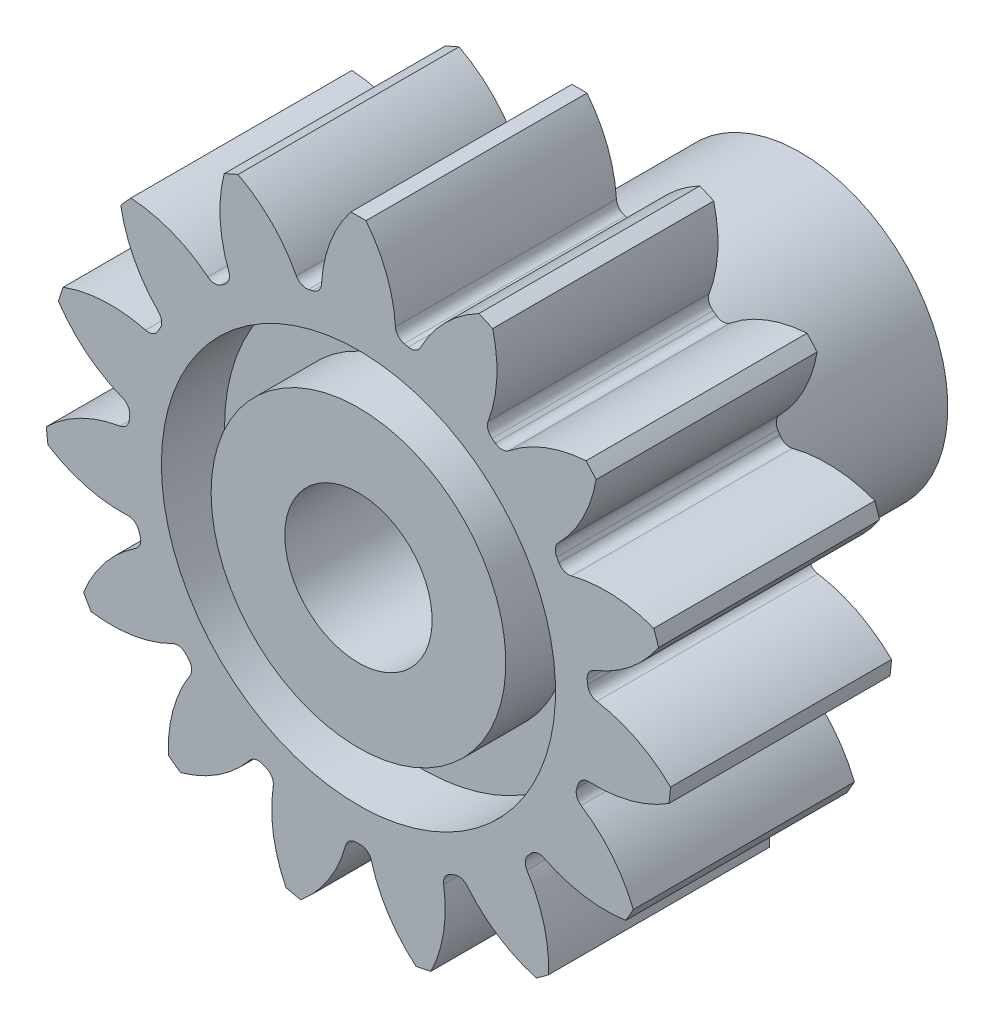
from build123d import *

# Parameters (mm, degrees)
CUT_EXTRUDE1_DEPTH = 17.985287751
CIRPATTERN1_COUNT  = 15


with BuildPart() as part:
    # Sketch3 → Revolve1 (revolve)
    with BuildSketch(Plane(origin=(0, 0, 0), x_dir=(0, 0, -1), z_dir=(1, 0, 0)), mode=Mode.PRIVATE) as revolve1_sk:
        Polygon((-6, 8.5), (0, 8.5), (0, 5.35), (-1.714285714, 5.35), (-1.714285714, 4), (6, 4), (6, 2), (-6, 2), (-6, 4), (-4.285714286, 4), (-4.285714286, 5.35), (-6, 5.35), align=None)
    revolve(revolve1_sk.sketch.rotate(Axis((0, 0, -6), (0, 0, 1)), 90), axis=Axis((0, 0, -6), (0, 0, 1)))

    # Sketch4 → Cut-Extrude1 (cut, symmetric)
    with BuildSketch(Plane.XY.offset(6)):
        with BuildLine():
            ThreePointArc((-0.205173142, 8.497523403), (-0.765925793, 7.511046812), (-1.003785702, 6.401541398))
            ThreePointArc((-1.003785702, 6.401541398), (-1.076631571, 6.222480393), (-1.24358339, 6.125030641))
            ThreePointArc((-1.24358339, 6.125030641), (-1.299448068, 6.113422505), (-1.355204444, 6.101304853))
            ThreePointArc((-1.355204444, 6.101304853), (-1.547358905, 6.12242421), (-1.68673759, 6.256375493))
            ThreePointArc((-1.68673759, 6.256375493), (-2.355309937, 7.173212783), (-3.268819151, 7.846325341))
            ThreePointArc((-3.268819151, 7.846325341), (-1.767249372, 8.314254606), (-0.205173142, 8.497523403))
        make_face()
    cut_extrude1 = extrude(amount=CUT_EXTRUDE1_DEPTH, both=True, mode=Mode.SUBTRACT)

    # CirPattern1: Cut-Extrude1 ×15 about axis
    cirpattern1_axis = Axis((0, 0, 0), (0, 0, 1))
    for i in range(1, CIRPATTERN1_COUNT):
        add(cut_extrude1.rotate(cirpattern1_axis, i * 360 / CIRPATTERN1_COUNT), mode=Mode.SUBTRACT)


solid = part.part
